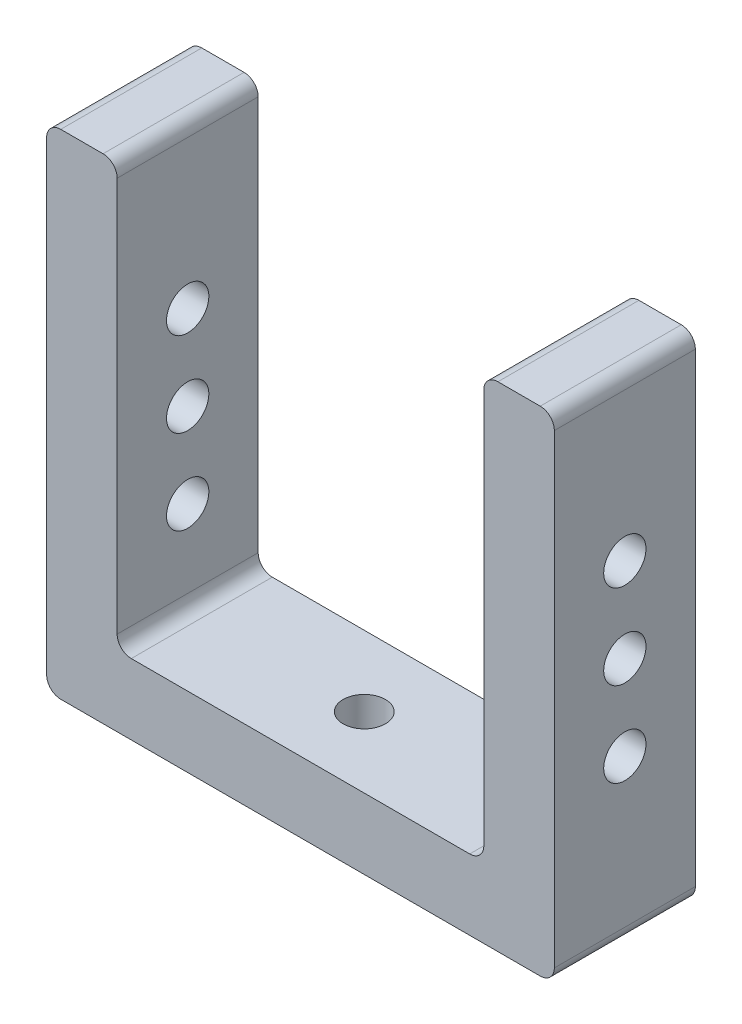
from build123d import *

# Parameters (mm, degrees)
EXTRUDE_1_DEPTH     = 10
FILLET_1_R          = 1
SKETCH_3_R          = 1.5
CUT_EXTRUDE_2_DEPTH = 6
SKETCH_2_R          = 1.5
CUT_EXTRUDE_3_DEPTH = 48.916594203


with BuildPart() as part:
    # 草图1 → 凸台-拉伸1 (new body)
    with BuildSketch(Plane.XY):
        with BuildLine():
            Line((-17.046320844, 30), (-12.046320844, 30))
            Line((-12.046320844, 30), (-12.046320844, 1))
            ThreePointArc((-12.046320844, 1), (-11.753427625, 0.292893219), (-11.046320844, 0))
            Line((-11.046320844, 0), (12.953679156, 0))
            ThreePointArc((12.953679156, 0), (13.660785937, 0.292893219), (13.953679156, 1))
            Line((13.953679156, 1), (13.953679156, 30))
            Line((13.953679156, 30), (18.953679156, 30))
            Line((18.953679156, 30), (18.953679156, -4))
            ThreePointArc((18.953679156, -4), (18.660785937, -4.707106781), (17.953679156, -5))
            Line((17.953679156, -5), (-16.046320844, -5))
            ThreePointArc((-16.046320844, -5), (-16.753427625, -4.707106781), (-17.046320844, -4))
            Line((-17.046320844, -4), (-17.046320844, 30))
        make_face()
    extrude(amount=EXTRUDE_1_DEPTH)

    # 圆角1
    fillet_1_edges = [part.edges().sort_by_distance(p)[0] for p in [
        (18.953679156, 30, 5),
        (13.953679156, 30, 5),
        (-12.046320844, 30, 5),
        (-17.046320844, 30, 5),
    ]]
    fillet(fillet_1_edges, radius=FILLET_1_R)

    # 草图3 → 切除-拉伸2 (cut)
    with BuildSketch(Plane.XZ.offset(5)):
        with Locations((0.476839578, 5)):
            Circle(SKETCH_3_R)
    extrude(amount=-CUT_EXTRUDE_2_DEPTH, mode=Mode.SUBTRACT)

    # 草图2 → 切除-拉伸3 (cut, through all)
    with BuildSketch(Plane.ZY.offset(17.046320844)):
        with Locations((5, 12.5)):
            Circle(SKETCH_2_R)
        with Locations((5, 6.5)):
            Circle(SKETCH_2_R)
        with Locations((5, 18.5)):
            Circle(SKETCH_2_R)
    extrude(amount=-CUT_EXTRUDE_3_DEPTH, mode=Mode.SUBTRACT)


solid = part.part
